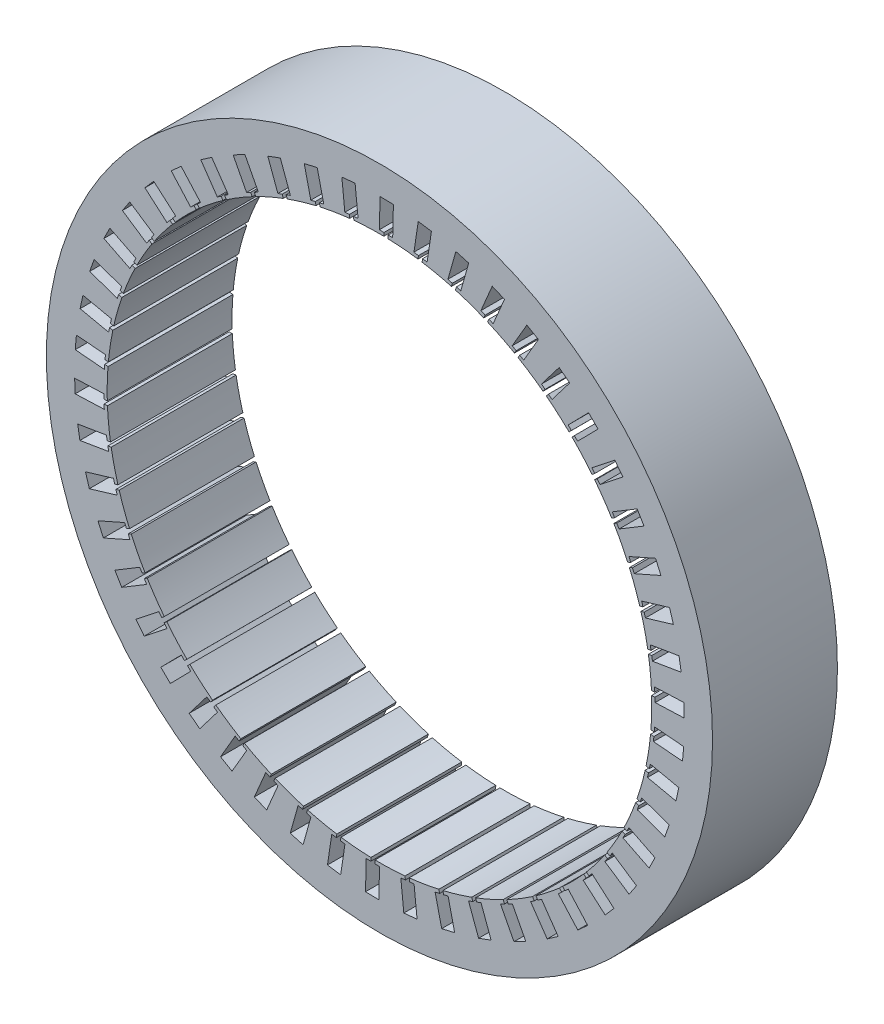
from build123d import *

# Parameters (mm, degrees)
ROTOR_STACK_START    = -15
SKETCH_1_R           = 80
SKETCH_1_R_2         = 65.4
ROTOR_STACK_DEPTH    = 30
ROTOR_50_SLOTS_DEPTH = 16


with BuildPart() as part:
    # Эскиз1 → Rotor_stack (new body)
    with BuildSketch(Plane.XY.offset(ROTOR_STACK_START)):
        Circle(SKETCH_1_R)
        Circle(SKETCH_1_R_2, mode=Mode.SUBTRACT)
    extrude(amount=ROTOR_STACK_DEPTH)

    # Эскиз2 → Rotor_50_slots (cut, symmetric)
    with BuildSketch(Plane.XY):
        Polygon((64.568528724, 2.01620891), (66.169248383, 2.078597706), (66.212088869, 0.979432253), (73.206778115, 1.25205353), (73.082151245, 4.449625757), (66.087462, 4.177004479), (66.130302486, 3.077839026), (64.529582828, 3.015450231), align=None)
        Polygon((63.806688607, 10.092892992), (65.386966724, 10.355413204), (65.567231361, 9.270284336), (72.472596886, 10.417422934), (71.94819067, 13.57416146), (65.042825145, 12.427022862), (65.223089781, 11.341893994), (63.642811665, 11.079373781), align=None)
        Polygon((62.038578895, 18.010406122), (63.57349354, 18.468917651), (63.888339446, 17.414938497), (70.595479511, 19.418503355), (69.679564148, 22.484624528), (62.972424082, 20.48105967), (63.287269988, 19.427080517), (61.752355344, 18.968568989), align=None)
        Polygon((59.292083733, 25.643884389), (60.757428385, 26.291156233), (61.201890252, 25.284948676), (67.605029253, 28.113342378), (66.312049275, 31.040491636), (59.908910274, 28.212097933), (60.353372142, 27.205890376), (58.88802749, 26.558618532), align=None)
        Polygon((55.610516992, 32.87294328), (56.98318229, 33.698767576), (57.55025069, 32.756200109), (63.548407298, 36.364817198), (61.898753772, 39.106831648), (55.900597163, 35.498214558), (56.467665563, 34.555647091), (55.095000265, 33.729822796), align=None)
        Polygon((51.051939177, 39.583576219), (52.31027737, 40.574929223), (52.991009295, 39.710866698), (58.489588998, 44.042797127), (56.509277945, 46.556433563), (51.010698241, 42.224503134), (51.691430166, 41.360440609), (50.433091973, 40.369087605), align=None)
        Polygon((45.688241785, 45.669952514), (46.812408128, 46.811199998), (47.596068028, 46.039269198), (52.50835494, 51.026195836), (50.228617048, 53.27181271), (45.316330136, 48.284886072), (46.099990036, 47.512955272), (44.975823693, 46.371707787), align=None)
        Polygon((39.604013526, 51.036086376), (40.576279244, 52.309230186), (41.450508336, 51.64160492), (45.699032757, 57.204880955), (43.155820855, 59.147063548), (38.907296434, 53.583787513), (39.781525525, 52.916162246), (38.809259807, 51.643018436), align=None)
        Polygon((32.895206317, 55.597350669), (33.700238199, 56.982312566), (34.651249366, 56.429521683), (38.169009528, 62.481410929), (35.402431588, 64.08952986), (31.884671425, 58.037640615), (32.835682592, 57.484849732), (32.03065071, 56.099887835), align=None)
        Polygon((25.667622053, 59.281811529), (26.292724265, 60.756749837), (27.305519494, 60.32751118), (30.037038218, 66.772571727), (27.090724825, 68.021266001), (24.359206101, 61.576205454), (25.372001329, 61.146966798), (24.746899117, 59.67202849), align=None)
        Polygon((18.035244056, 62.031362808), (18.470558363, 63.573016869), (19.529165267, 63.274099788), (21.431364872, 70.010689182), (18.351781149, 70.880266144), (16.449581545, 64.14367675), (17.508188449, 63.844759669), (17.072874142, 62.303105609), align=None)
        Polygon((10.118439486, 63.80264244), (10.357100722, 65.386699448), (11.444824439, 65.222818044), (12.4877061, 72.144696246), (9.323418922, 72.621442148), (8.280537261, 65.699563946), (9.368260978, 65.535682542), (9.129599743, 63.951625535), align=None)
        Polygon((2.042061082, 64.567716287), (2.080305415, 66.169194716), (3.179991892, 66.142933497), (3.347108742, 73.140938352), (0.148020808, 73.217334627), (-0.019096042, 66.219329771), (1.080590436, 66.193068552), (1.042346102, 64.591590123), align=None)
        Polygon((-6.066521846, 64.314518677), (-6.229297551, 65.908162256), (-5.134991026, 66.019935377), (-5.846274519, 72.983704169), (-9.029711682, 72.658546001), (-8.318428188, 65.694777209), (-7.224121664, 65.806550329), (-7.061345959, 64.21290675), align=None)
        Polygon((-14.0794321, 63.047042688), (-14.440660773, 64.607718706), (-13.368992069, 64.855763438), (-14.94745854, 71.675473373), (-18.065040224, 70.9538887), (-16.486573753, 64.134178765), (-15.414905049, 64.382223496), (-15.053676377, 62.821547478), align=None)
        Polygon((-21.8703013, 60.785277174), (-22.424286148, 62.288372838), (-21.39215612, 62.668777366), (-23.812912209, 69.236877544), (-26.815472291, 68.130246189), (-24.394716202, 61.562146011), (-23.362586174, 61.942550539), (-22.808601325, 60.439454875), align=None)
        Polygon((-29.316262783, 57.564891526), (-30.054267135, 58.98670212), (-29.07795309, 59.493467239), (-32.302822029, 65.706374797), (-35.143008341, 64.232148997), (-31.918139403, 58.019241438), (-30.941825358, 58.526006557), (-30.203821005, 57.104195964), align=None)
        Polygon((-36.299889289, 53.436673152), (-37.210274376, 54.754775873), (-36.30517337, 55.379909593), (-40.283297048, 61.139643268), (-42.916318156, 59.321072444), (-38.938194478, 53.561338769), (-38.033093472, 54.18647249), (-37.122708386, 52.86836977), align=None)
        Polygon((-42.711044857, 48.465726521), (-43.779453362, 49.659334101), (-42.959839378, 50.392977692), (-47.628480408, 55.608703042), (-50.012811997, 53.474467142), (-45.344170967, 48.258741792), (-44.524556983, 48.992385382), (-43.456148478, 47.798777803), align=None)
        Polygon((-48.448621733, 42.730446431), (-49.658204215, 43.780734966), (-48.937003056, 44.611318428), (-54.222534181, 49.20078035), (-56.320573916, 46.78453755), (-51.035042791, 42.195075628), (-50.313841632, 43.025659091), (-49.10425915, 41.975370556), align=None)
        Polygon((-53.422134903, 36.321281674), (-54.753815524, 37.211687487), (-54.142400962, 38.126112024), (-59.961466198, 42.01693196), (-61.740126741, 39.356787852), (-55.921061505, 35.465967916), (-55.309646943, 36.380392453), (-53.977966322, 35.48998664), align=None)
        Polygon((-57.553149092, 29.339308608), (-58.985926453, 30.055789467), (-58.493940862, 31.039634057), (-64.754770075, 34.170451454), (-66.186000885, 31.308358099), (-59.925171672, 28.177540703), (-59.433186081, 29.161385293), (-58.00040872, 28.444904435), align=None)
        Polygon((-60.776515739, 21.894637119), (-62.287794086, 22.425893692), (-61.922996372, 23.463642519), (-68.526852545, 25.785082516), (-69.588082257, 22.766176837), (-62.984226085, 20.444736841), (-62.619428371, 21.482485668), (-61.108150025, 20.951229094), align=None)
        Polygon((-63.041400428, 14.104674123), (-64.607345997, 14.442328178), (-64.375489239, 15.517615322), (-71.218225614, 16.993067423), (-71.892718002, 13.864959366), (-65.049981627, 12.389507265), (-64.818124869, 13.46479441), (-63.252179299, 13.127140356), align=None)
        Polygon((-64.312084572, 6.092271991), (-65.908001467, 6.230998521), (-65.812742183, 7.326866062), (-72.786444721, 7.933061506), (-73.063562638, 4.745083203), (-66.089860101, 4.138887759), (-65.994600817, 5.234755301), (-64.398683921, 5.096028771), align=None)
        Polygon((-64.568528724, -2.01620891), (-66.169248383, -2.078597706), (-66.212088869, -0.979432253), (-73.206778115, -1.25205353), (-73.082151245, -4.449625757), (-66.087462, -4.177004479), (-66.130302486, -3.077839026), (-64.529582828, -3.015450231), align=None)
        Polygon((-63.806688607, -10.092892992), (-65.386966724, -10.355413204), (-65.567231361, -9.270284336), (-72.472596886, -10.417422934), (-71.94819067, -13.57416146), (-65.042825145, -12.427022862), (-65.223089781, -11.341893994), (-63.642811665, -11.079373781), align=None)
        Polygon((-62.038578895, -18.010406122), (-63.57349354, -18.468917651), (-63.888339446, -17.414938497), (-70.595479511, -19.418503355), (-69.679564148, -22.484624528), (-62.972424082, -20.48105967), (-63.287269988, -19.427080517), (-61.752355344, -18.968568989), align=None)
        Polygon((-59.292083733, -25.643884389), (-60.757428385, -26.291156233), (-61.201890252, -25.284948676), (-67.605029253, -28.113342378), (-66.312049275, -31.040491636), (-59.908910274, -28.212097933), (-60.353372142, -27.205890376), (-58.88802749, -26.558618532), align=None)
        Polygon((-55.610516992, -32.87294328), (-56.98318229, -33.698767576), (-57.55025069, -32.756200109), (-63.548407298, -36.364817198), (-61.898753772, -39.106831648), (-55.900597163, -35.498214558), (-56.467665563, -34.555647091), (-55.095000265, -33.729822796), align=None)
        Polygon((-51.051939177, -39.583576219), (-52.31027737, -40.574929223), (-52.991009295, -39.710866698), (-58.489588998, -44.042797127), (-56.509277945, -46.556433563), (-51.010698241, -42.224503134), (-51.691430166, -41.360440609), (-50.433091973, -40.369087605), align=None)
        Polygon((-45.688241785, -45.669952514), (-46.812408128, -46.811199998), (-47.596068028, -46.039269198), (-52.50835494, -51.026195836), (-50.228617048, -53.27181271), (-45.316330136, -48.284886072), (-46.099990036, -47.512955272), (-44.975823693, -46.371707787), align=None)
        Polygon((-39.604013526, -51.036086376), (-40.576279244, -52.309230186), (-41.450508336, -51.64160492), (-45.699032757, -57.204880955), (-43.155820855, -59.147063548), (-38.907296434, -53.583787513), (-39.781525525, -52.916162246), (-38.809259807, -51.643018436), align=None)
        Polygon((-32.895206317, -55.597350669), (-33.700238199, -56.982312566), (-34.651249366, -56.429521683), (-38.169009528, -62.481410929), (-35.402431588, -64.08952986), (-31.884671425, -58.037640615), (-32.835682592, -57.484849732), (-32.03065071, -56.099887835), align=None)
        Polygon((-25.667622053, -59.281811529), (-26.292724265, -60.756749837), (-27.305519494, -60.32751118), (-30.037038218, -66.772571727), (-27.090724825, -68.021266001), (-24.359206101, -61.576205454), (-25.372001329, -61.146966798), (-24.746899117, -59.67202849), align=None)
        Polygon((-18.035244056, -62.031362808), (-18.470558363, -63.573016869), (-19.529165267, -63.274099788), (-21.431364872, -70.010689182), (-18.351781149, -70.880266144), (-16.449581545, -64.14367675), (-17.508188449, -63.844759669), (-17.072874142, -62.303105609), align=None)
        Polygon((-10.118439486, -63.80264244), (-10.357100722, -65.386699448), (-11.444824439, -65.222818044), (-12.4877061, -72.144696246), (-9.323418922, -72.621442148), (-8.280537261, -65.699563946), (-9.368260978, -65.535682542), (-9.129599743, -63.951625535), align=None)
        Polygon((-2.042061082, -64.567716287), (-2.080305415, -66.169194716), (-3.179991892, -66.142933497), (-3.347108742, -73.140938352), (-0.148020808, -73.217334627), (0.019096042, -66.219329771), (-1.080590436, -66.193068552), (-1.042346102, -64.591590123), align=None)
        Polygon((6.066521846, -64.314518677), (6.229297551, -65.908162256), (5.134991026, -66.019935377), (5.846274519, -72.983704169), (9.029711682, -72.658546001), (8.318428188, -65.694777209), (7.224121664, -65.806550329), (7.061345959, -64.21290675), align=None)
        Polygon((14.0794321, -63.047042688), (14.440660773, -64.607718706), (13.368992069, -64.855763438), (14.94745854, -71.675473373), (18.065040224, -70.9538887), (16.486573753, -64.134178765), (15.414905049, -64.382223496), (15.053676377, -62.821547478), align=None)
        Polygon((21.8703013, -60.785277174), (22.424286148, -62.288372838), (21.39215612, -62.668777366), (23.812912209, -69.236877544), (26.815472291, -68.130246189), (24.394716202, -61.562146011), (23.362586174, -61.942550539), (22.808601325, -60.439454875), align=None)
        Polygon((29.316262783, -57.564891526), (30.054267135, -58.98670212), (29.07795309, -59.493467239), (32.302822029, -65.706374797), (35.143008341, -64.232148997), (31.918139403, -58.019241438), (30.941825358, -58.526006557), (30.203821005, -57.104195964), align=None)
        Polygon((36.299889289, -53.436673152), (37.210274376, -54.754775873), (36.30517337, -55.379909593), (40.283297048, -61.139643268), (42.916318156, -59.321072444), (38.938194478, -53.561338769), (38.033093472, -54.18647249), (37.122708386, -52.86836977), align=None)
        Polygon((42.711044857, -48.465726521), (43.779453362, -49.659334101), (42.959839378, -50.392977692), (47.628480408, -55.608703042), (50.012811997, -53.474467142), (45.344170967, -48.258741792), (44.524556983, -48.992385382), (43.456148478, -47.798777803), align=None)
        Polygon((48.448621733, -42.730446431), (49.658204215, -43.780734966), (48.937003056, -44.611318428), (54.222534181, -49.20078035), (56.320573916, -46.78453755), (51.035042791, -42.195075628), (50.313841632, -43.025659091), (49.10425915, -41.975370556), align=None)
        Polygon((53.422134903, -36.321281674), (54.753815524, -37.211687487), (54.142400962, -38.126112024), (59.961466198, -42.01693196), (61.740126741, -39.356787852), (55.921061505, -35.465967916), (55.309646943, -36.380392453), (53.977966322, -35.48998664), align=None)
        Polygon((57.553149092, -29.339308608), (58.985926453, -30.055789467), (58.493940862, -31.039634057), (64.754770075, -34.170451454), (66.186000885, -31.308358099), (59.925171672, -28.177540703), (59.433186081, -29.161385293), (58.00040872, -28.444904435), align=None)
        Polygon((60.776515739, -21.894637119), (62.287794086, -22.425893692), (61.922996372, -23.463642519), (68.526852545, -25.785082516), (69.588082257, -22.766176837), (62.984226085, -20.444736841), (62.619428371, -21.482485668), (61.108150025, -20.951229094), align=None)
        Polygon((63.041400428, -14.104674123), (64.607345997, -14.442328178), (64.375489239, -15.517615322), (71.218225614, -16.993067423), (71.892718002, -13.864959366), (65.049981627, -12.389507265), (64.818124869, -13.46479441), (63.252179299, -13.127140356), align=None)
        Polygon((64.312084572, -6.092271991), (65.908001467, -6.230998521), (65.812742183, -7.326866062), (72.786444721, -7.933061506), (73.063562638, -4.745083203), (66.089860101, -4.138887759), (65.994600817, -5.234755301), (64.398683921, -5.096028771), align=None)
    extrude(amount=ROTOR_50_SLOTS_DEPTH, both=True, mode=Mode.SUBTRACT)


solid = part.part
